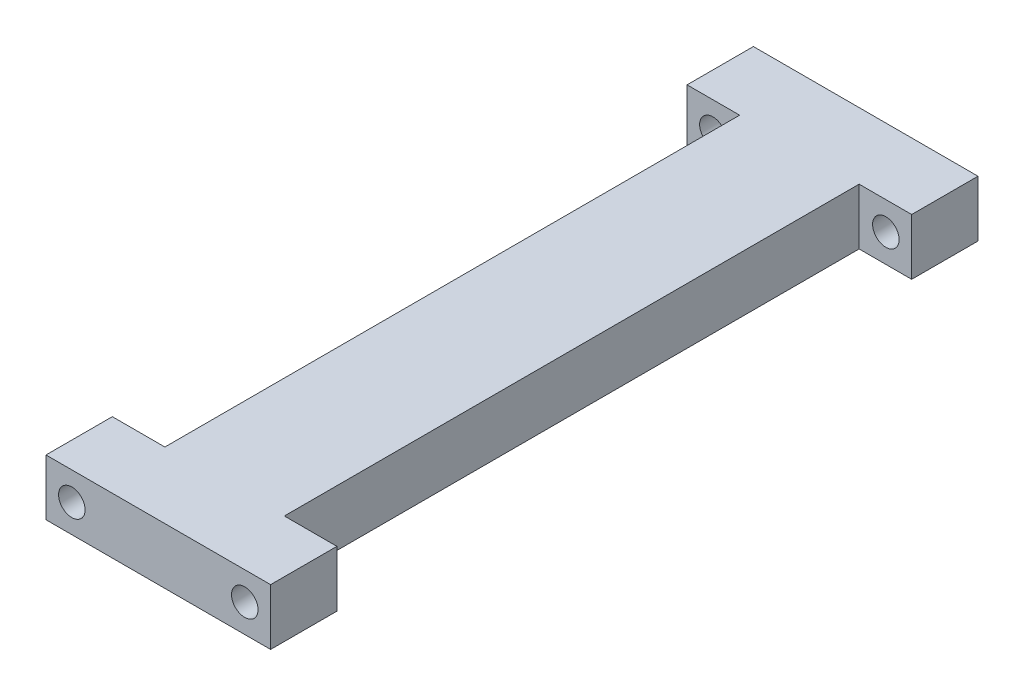
from build123d import *

# Parameters (mm, degrees)
BOSS_EXTRUDE3_DEPTH   = 3.175
F_3_0MM_DOWEL_HOLE1_D = 3


with BuildPart() as part:
    # Sketch7 → Boss-Extrude3 (new, symmetric)
    with BuildSketch(Plane(origin=(0, 0, 0), x_dir=(1, 0, 0), z_dir=(0, 1, 0))):
        Polygon((-12.7, -32.5), (-12.7, -40), (12.7, -40), (12.7, -32.5), (6.7564, -32.5), (6.7564, 32.5), (12.7, 32.5), (12.7, 40), (-12.7, 40), (-12.7, 32.5), (-6.7564, 32.5), (-6.7564, -32.5), align=None)
    extrude(amount=BOSS_EXTRUDE3_DEPTH, both=True)

    # Ø3.0mm Dowel Hole1 (through all)
    with Locations(Plane(origin=(0, 0, -40), x_dir=(-1, 0, 0), z_dir=(0, 0, -1))):
        with Locations((-9.779, 0), (9.779, 0)):
            Hole(F_3_0MM_DOWEL_HOLE1_D / 2)


solid = part.part
